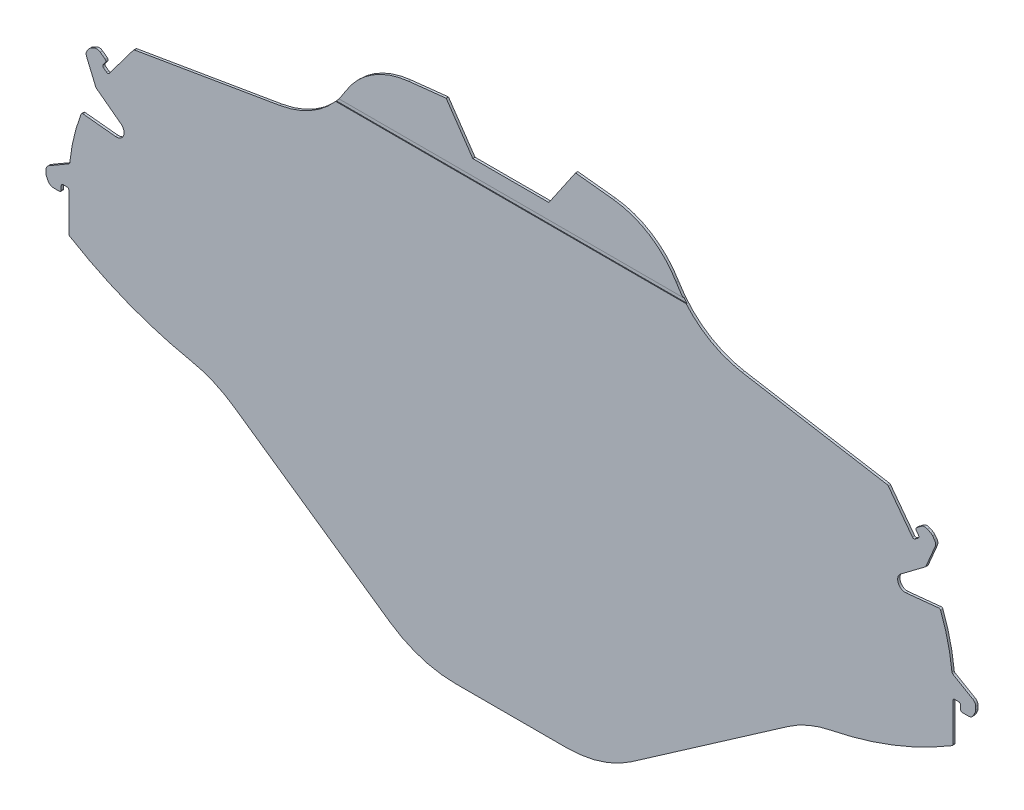
from build123d import *

# Parameters (mm, degrees)
MAIN_SHAPE_DEPTH        = 0.6
TABS_DEPTH              = 154.060061459
TABS_DEPTH_BACK         = 154.060061459
CHIN_GUARD_DEPTH        = 0.6
FILLET1_R               = 30
SKETCH8_W               = 100
SKETCH8_H               = 1
CUT_EXTRUDE3_DEPTH      = 0.2
BOSS_EXTRUDE1_START     = -0.6
BOSS_EXTRUDE1_DEPTH     = 0.6
CUT_EXTRUDE4_DEPTH      = 173.475044334
CUT_EXTRUDE4_DEPTH_BACK = 173.475044334
FILLET2_R               = 0.5
FILLET3_R               = 1.5


with BuildPart() as part:
    # Sketch1 → Main Shape (new body)
    with BuildSketch(Plane.XY):
        with BuildLine():
            Line((-24, -91.764766734), (24, -91.764766734))
            Line((24, -91.764766734), (78.266232563, -84.05670244))
            ThreePointArc((78.266232563, -84.05670244), (97.655491519, -79.289252293), (115.711102551, -70.764766734))
            ThreePointArc((115.711102551, -70.764766734), (120.685143325, -65.658407438), (122.5, -58.764766734))
            ThreePointArc((122.5, -58.764766734), (120.227482046, -43.118277124), (113.597722286, -28.764766734))
            ThreePointArc((113.597722286, -28.764766734), (107.811505455, -22.955172168), (100.180351554, -19.955641477))
            Line((100.180351554, -19.955641477), (60.74391922, -13.264766734))
            ThreePointArc((60.74391922, -13.264766734), (50.804108255, -9.246591688), (43.461443341, -1.434367632))
            ThreePointArc((43.461443341, -1.434367632), (36.448172688, 5.805997675), (26.941855461, 9.15842781))
            Line((26.941855461, 9.15842781), (17, 10.235233266))
            Line((17, 10.235233266), (10, 0))
            Line((10, 0), (-10, 0))
            Line((-10, 0), (-17, 10.235233266))
            Line((-17, 10.235233266), (-26.941855461, 9.15842781))
            ThreePointArc((-26.941855461, 9.15842781), (-36.448172688, 5.805997675), (-43.461443341, -1.434367632))
            ThreePointArc((-43.461443341, -1.434367632), (-50.804108255, -9.246591688), (-60.74391922, -13.264766734))
            Line((-60.74391922, -13.264766734), (-100.180351554, -19.955641477))
            ThreePointArc((-100.180351554, -19.955641477), (-107.811505455, -22.955172168), (-113.597722286, -28.764766734))
            ThreePointArc((-113.597722286, -28.764766734), (-120.227482046, -43.118277124), (-122.5, -58.764766734))
            ThreePointArc((-122.5, -58.764766734), (-120.685143325, -65.658407438), (-115.711102551, -70.764766734))
            ThreePointArc((-115.711102551, -70.764766734), (-97.655491519, -79.289252293), (-78.266232563, -84.05670244))
            Line((-78.266232563, -84.05670244), (-24, -91.764766734))
        make_face()
    extrude(amount=MAIN_SHAPE_DEPTH)

    # Sketch2 → Tabs (cut, two sides: drawn at the far end of the back side and taken through both)
    with BuildSketch(Plane.XY.offset(0.6).offset(-TABS_DEPTH_BACK)):
        with BuildLine():
            Line((-121.15, -59.764766734), (-121.15, -57.764766734))
            Line((-121.15, -57.764766734), (-115.985504489, -54.767473344))
            ThreePointArc((-115.985504489, -54.767473344), (-113.65344245, -43.380285918), (-108.686779625, -32.871298753))
            Line((-108.686779625, -32.871298753), (-111.02, -27.374766734))
            Line((-111.02, -27.374766734), (-109.82, -25.774766734))
            Line((-109.82, -25.774766734), (-107.82, -24.774766734))
            Line((-107.82, -24.774766734), (-106.22, -25.974766734))
            Line((-106.22, -25.974766734), (-107.42, -27.574766734))
            Line((-107.42, -27.574766734), (-105.82, -28.774766734))
            Line((-105.82, -28.774766734), (-99.063546264, -19.766161753))
            Line((-99.063546264, -19.766161753), (-100.180351554, -19.955641477))
            ThreePointArc((-100.180351554, -19.955641477), (-107.811505455, -22.955172168), (-113.597722286, -28.764766734))
            ThreePointArc((-113.597722286, -28.764766734), (-120.227482046, -43.118277124), (-122.5, -58.764766734))
            ThreePointArc((-122.5, -58.764766734), (-120.810564569, -65.431850055), (-116.15, -70.489846692))
            Line((-116.15, -70.489846692), (-116.15, -59.764766734))
            Line((-116.15, -59.764766734), (-118.15, -59.764766734))
            Line((-118.15, -59.764766734), (-118.15, -61.764766734))
            Line((-118.15, -61.764766734), (-120.15, -61.764766734))
            Line((-120.15, -61.764766734), (-121.15, -59.764766734))
        make_face()
        with BuildLine():
            Line((105.82, -28.774766734), (99.063546264, -19.766161753))
            Line((99.063546264, -19.766161753), (100.180351554, -19.955641477))
            ThreePointArc((100.180351554, -19.955641477), (107.811505455, -22.955172168), (113.597722286, -28.764766734))
            ThreePointArc((113.597722286, -28.764766734), (120.227482046, -43.118277124), (122.5, -58.764766734))
            ThreePointArc((122.5, -58.764766734), (120.810564569, -65.431850055), (116.15, -70.489846692))
            Line((116.15, -70.489846692), (116.15, -59.764766734))
            Line((116.15, -59.764766734), (118.15, -59.764766734))
            Line((118.15, -59.764766734), (118.15, -61.764766734))
            Line((118.15, -61.764766734), (120.15, -61.764766734))
            Line((120.15, -61.764766734), (121.15, -59.764766734))
            Line((121.15, -59.764766734), (121.15, -57.764766734))
            Line((121.15, -57.764766734), (115.985504489, -54.767473344))
            ThreePointArc((115.985504489, -54.767473344), (113.65344245, -43.380285918), (108.686779625, -32.871298753))
            Line((108.686779625, -32.871298753), (111.02, -27.374766734))
            Line((111.02, -27.374766734), (109.82, -25.774766734))
            Line((109.82, -25.774766734), (107.82, -24.774766734))
            Line((107.82, -24.774766734), (106.22, -25.974766734))
            Line((106.22, -25.974766734), (107.42, -27.574766734))
            Line((107.42, -27.574766734), (105.82, -28.774766734))
        make_face()
    extrude(amount=TABS_DEPTH + TABS_DEPTH_BACK, mode=Mode.SUBTRACT)

    # Sketch5 → Chin guard (add)
    with BuildSketch(Plane.XY.offset(0.6)):
        Polygon((-78.266232563, -84.05670244), (-24, -121.764766734), (24, -121.764766734), (78.266232563, -84.05670244), (24, -91.764766734), (-24, -91.764766734), align=None)
    extrude(amount=-CHIN_GUARD_DEPTH)

    # Fillet1
    fillet1_edges = [part.edges().sort_by_distance(p)[0] for p in [
        (-24, -121.764766734, 0.3),
        (24, -121.764766734, 0.3),
        (78.266232563, -84.05670244, 0.3),
        (-78.266232563, -84.05670244, 0.3),
    ]]
    fillet(fillet1_edges, radius=FILLET1_R)

    # Sketch8 → Cut-Extrude3 (cut)
    with BuildSketch(Plane.XY.offset(0.6)):
        with Locations((0, -4.5)):
            Rectangle(SKETCH8_W, SKETCH8_H)
    extrude(amount=-CUT_EXTRUDE3_DEPTH, mode=Mode.SUBTRACT)

    # Sketch9 → Boss-Extrude1 (add)
    with BuildSketch(Plane.XY.offset(0.6).offset(BOSS_EXTRUDE1_START)):
        with BuildLine():
            Line((-121.15, -61.764766734), (-120.15, -61.764766734))
            Line((-120.15, -61.764766734), (-121.15, -59.764766734))
            Line((-121.15, -59.764766734), (-121.15, -57.764766734))
            Line((-121.15, -57.764766734), (-115.985504489, -54.767473344))
            ThreePointArc((-115.985504489, -54.767473344), (-115.959300984, -54.461436848), (-115.931165822, -54.155571889))
            Line((-115.931165822, -54.155571889), (-122.15, -57.764766734))
            Line((-122.15, -57.764766734), (-122.15, -59.764766734))
            Line((-122.15, -59.764766734), (-121.15, -61.764766734))
        make_face()
        with BuildLine():
            Line((-111.02, -27.374766734), (-108.686779625, -32.871298753))
            ThreePointArc((-108.686779625, -32.871298753), (-108.849438719, -33.131850053), (-109.010449565, -33.393423117))
            Line((-109.010449565, -33.393423117), (-111.82, -26.774766734))
            Line((-111.82, -26.774766734), (-110.62, -25.174766734))
            Line((-110.62, -25.174766734), (-108.62, -24.174766734))
            Line((-108.62, -24.174766734), (-107.82, -24.774766734))
            Line((-107.82, -24.774766734), (-109.82, -25.774766734))
            Line((-109.82, -25.774766734), (-111.02, -27.374766734))
        make_face()
        with BuildLine():
            Line((108.62, -24.174766734), (107.82, -24.774766734))
            Line((107.82, -24.774766734), (109.82, -25.774766734))
            Line((109.82, -25.774766734), (111.02, -27.374766734))
            Line((111.02, -27.374766734), (108.686779625, -32.871298753))
            ThreePointArc((108.686779625, -32.871298753), (108.849438719, -33.131850053), (109.010449565, -33.393423117))
            Line((109.010449565, -33.393423117), (111.82, -26.774766734))
            Line((111.82, -26.774766734), (110.62, -25.174766734))
            Line((110.62, -25.174766734), (108.62, -24.174766734))
        make_face()
        with BuildLine():
            Line((121.15, -57.764766734), (115.985504489, -54.767473344))
            ThreePointArc((115.985504489, -54.767473344), (115.959300984, -54.461436848), (115.931165822, -54.155571889))
            Line((115.931165822, -54.155571889), (122.15, -57.764766734))
            Line((122.15, -57.764766734), (122.15, -59.764766734))
            Line((122.15, -59.764766734), (121.15, -61.764766734))
            Line((121.15, -61.764766734), (120.15, -61.764766734))
            Line((120.15, -61.764766734), (121.15, -59.764766734))
            Line((121.15, -59.764766734), (121.15, -57.764766734))
        make_face()
    extrude(amount=BOSS_EXTRUDE1_DEPTH)

    # Sketch7 → Cut-Extrude4 (cut, two sides: drawn at the far end of the back side and taken through both)
    with BuildSketch(Plane.XY.offset(0.6).offset(-CUT_EXTRUDE4_DEPTH_BACK)):
        with BuildLine():
            Line((-103.838644773, -41.913383247), (-112.792739682, -41.005537243))
            ThreePointArc((-112.792739682, -41.005537243), (-111.068159087, -37.116718005), (-109.010449565, -33.393423117))
            Line((-109.010449565, -33.393423117), (-102.436901217, -38.323584378))
            ThreePointArc((-102.436901217, -38.323584378), (-101.773894786, -40.651050555), (-103.838644773, -41.913383247))
        make_face()
        with BuildLine():
            Line((109.010449565, -33.393423117), (102.436901217, -38.323584378))
            ThreePointArc((102.436901217, -38.323584378), (101.773894786, -40.651050555), (103.838644773, -41.913383247))
            Line((103.838644773, -41.913383247), (112.792739682, -41.005537243))
            ThreePointArc((112.792739682, -41.005537243), (111.068159087, -37.116718005), (109.010449565, -33.393423117))
        make_face()
    extrude(amount=CUT_EXTRUDE4_DEPTH + CUT_EXTRUDE4_DEPTH_BACK, mode=Mode.SUBTRACT)

    # Fillet2
    fillet2_edges = [part.edges().sort_by_distance(p)[0] for p in [
        (109.010449565, -33.393423117, 0.3),
        (-112.792739682, -41.005537243, 0.3),
        (-109.010449565, -33.393423117, 0.3),
        (-106.22, -25.974766734, 0.3),
        (-107.42, -27.574766734, 0.3),
        (-105.82, -28.774766734, 0.3),
        (-115.931165822, -54.155571889, 0.3),
        (-118.15, -61.764766734, 0.3),
        (-116.15, -59.764766734, 0.3),
        (-118.15, -59.764766734, 0.3),
        (118.15, -61.764766734, 0.3),
        (118.15, -59.764766734, 0.3),
        (116.15, -59.764766734, 0.3),
        (105.82, -28.774766734, 0.3),
        (107.42, -27.574766734, 0.3),
        (106.22, -25.974766734, 0.3),
        (116.15, -70.489846692, 0.3),
        (115.931165822, -54.155571889, 0.3),
        (112.792739682, -41.005537243, 0.3),
        (99.063546264, -19.766161753, 0.3),
        (-99.063546264, -19.766161753, 0.3),
        (-116.15, -70.489846692, 0.3),
    ]]
    fillet(fillet2_edges, radius=FILLET2_R)

    # Fillet3
    fillet3_edges = [part.edges().sort_by_distance(p)[0] for p in [
        (-122.15, -57.764766734, 0.3),
        (-122.15, -59.764766734, 0.3),
        (-121.15, -61.764766734, 0.3),
        (-108.62, -24.174766734, 0.3),
        (-110.62, -25.174766734, 0.3),
        (-111.82, -26.774766734, 0.3),
        (121.15, -61.764766734, 0.3),
        (122.15, -59.764766734, 0.3),
        (122.15, -57.764766734, 0.3),
        (111.82, -26.774766734, 0.3),
        (110.62, -25.174766734, 0.3),
        (108.62, -24.174766734, 0.3),
    ]]
    fillet(fillet3_edges, radius=FILLET3_R)


solid = part.part
